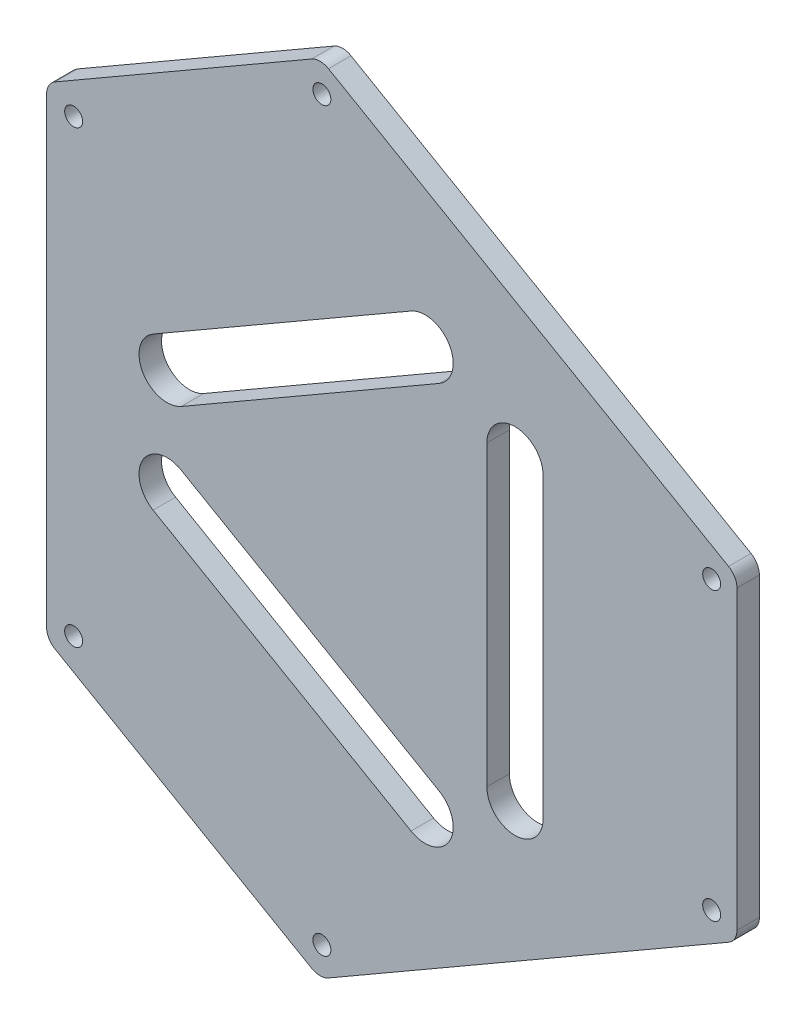
from build123d import *

# Parameters (mm, degrees)
SKETCH_1_R      = 1.6
EXTRUDE_1_DEPTH = 4
FILLET_1_R      = 3


with BuildPart() as part:
    # 草图1 → 凸台-拉伸1 (new body)
    with BuildSketch(Plane.XY):
        Polygon((65.464500341, 28.098076211), (65.464500341, -28.098076211), (-8.718623412, -70.927722679), (-57.385919005, -42.829646468), (-57.385919005, 42.829646468), (-8.718623412, 70.927722679), align=None)
        with Locations((60.964500341, 25.5)):
            Circle(SKETCH_1_R, mode=Mode.SUBTRACT)
        with Locations((60.964500341, -25.5)):
            Circle(SKETCH_1_R, mode=Mode.SUBTRACT)
        with Locations((-8.398602374, -65.546806024)):
            Circle(SKETCH_1_R, mode=Mode.SUBTRACT)
        with Locations((-52.565897967, -40.046806024)):
            Circle(SKETCH_1_R, mode=Mode.SUBTRACT)
        with Locations((-52.565897967, 40.046806024)):
            Circle(SKETCH_1_R, mode=Mode.SUBTRACT)
        with Locations((-8.398602374, 65.546806024)):
            Circle(SKETCH_1_R, mode=Mode.SUBTRACT)
        with BuildLine():
            Line((30.964500341, 26.5), (30.964500341, -26.5))
            ThreePointArc((30.964500341, -26.5), (25.964500341, -31.5), (20.964500341, -26.5))
            Line((20.964500341, -26.5), (20.964500341, 26.5))
            ThreePointArc((20.964500341, 26.5), (25.964500341, 31.5), (30.964500341, 26.5))
        make_face(mode=Mode.SUBTRACT)
        with BuildLine():
            Line((7.46742303, -40.06604391), (-38.431923371, -13.56604391))
            ThreePointArc((-38.431923371, -13.56604391), (-40.26205039, -6.735916892), (-33.431923371, -4.905789873))
            Line((-33.431923371, -4.905789873), (12.46742303, -31.405789873))
            ThreePointArc((12.46742303, -31.405789873), (14.297550049, -38.235916892), (7.46742303, -40.06604391))
        make_face(mode=Mode.SUBTRACT)
        with BuildLine():
            Line((-38.431923371, 13.56604391), (7.46742303, 40.06604391))
            ThreePointArc((7.46742303, 40.06604391), (14.297550049, 38.235916892), (12.46742303, 31.405789873))
            Line((12.46742303, 31.405789873), (-33.431923371, 4.905789873))
            ThreePointArc((-33.431923371, 4.905789873), (-40.26205039, 6.735916892), (-38.431923371, 13.56604391))
        make_face(mode=Mode.SUBTRACT)
    extrude(amount=EXTRUDE_1_DEPTH)

    # 圆角1
    fillet_1_edges = [part.edges().sort_by_distance(p)[0] for p in [
        (-57.385919005, 42.829646468, 2),
        (-8.718623412, 70.927722679, 2),
        (65.464500341, 28.098076211, 2),
        (65.464500341, -28.098076211, 2),
        (-8.718623412, -70.927722679, 2),
        (-57.385919005, -42.829646468, 2),
    ]]
    fillet(fillet_1_edges, radius=FILLET_1_R)


solid = part.part
